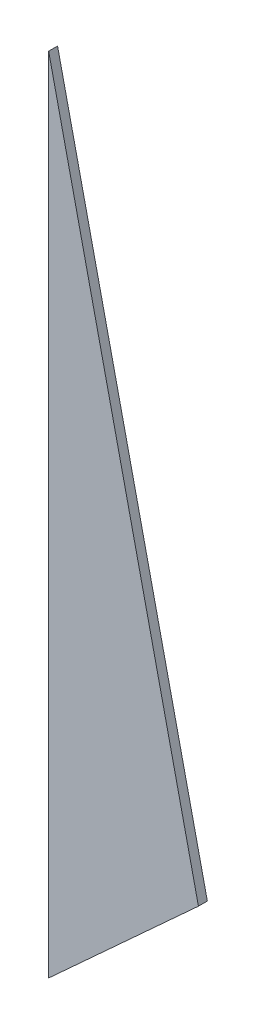
from build123d import *

# Parameters (mm, degrees)
BOSS_EXTRUDE1_DEPTH = 0.5


with BuildPart() as part:
    # Sketch1 → Boss-Extrude1 (new, symmetric)
    with BuildSketch(Plane.XY):
        Polygon((0, -45), (0, 45), (16.794320409, -29.632261311), align=None)
    extrude(amount=BOSS_EXTRUDE1_DEPTH, both=True)


solid = part.part
